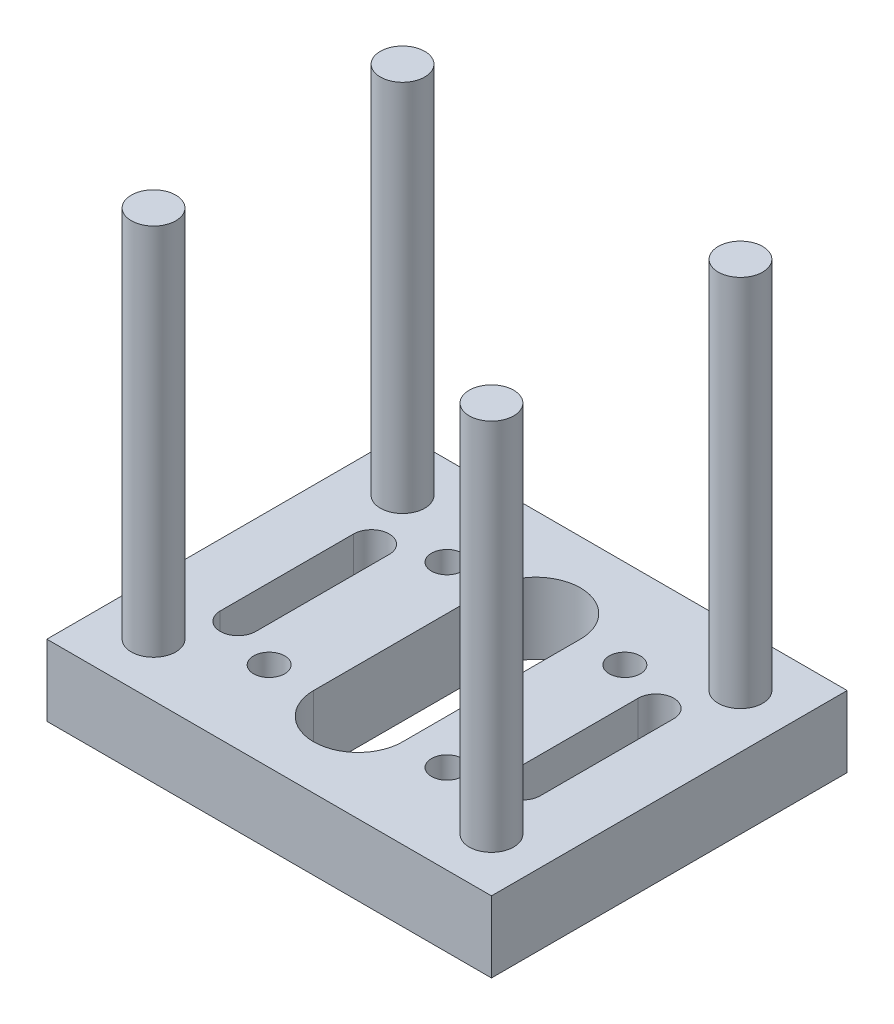
from build123d import *

# Parameters (mm, degrees)
SKETCH1_W            = 50
SKETCH1_H            = 40
SKETCH1_R            = 2.5
SKETCH1_R_2          = 1.75
MAIN_STRUCTURE_DEPTH = 8
SKETCH1_3_R          = 2.5
BOSS_EXTRUDE2_DEPTH  = 3
SKETCH1_4_R          = 2.5
SHAFTS_DEPTH         = 50


with BuildPart() as part:
    # Sketch1 → Main Structure (new body)
    with BuildSketch(Plane(origin=(0, 0, 0), x_dir=(1, 0, 0), z_dir=(0, 1, 0))):
        Rectangle(SKETCH1_W, SKETCH1_H)
        with Locations((-19, 14)):
            Circle(SKETCH1_R, mode=Mode.SUBTRACT)
        with Locations((-19, -14)):
            Circle(SKETCH1_R, mode=Mode.SUBTRACT)
        with Locations((19, 14)):
            Circle(SKETCH1_R, mode=Mode.SUBTRACT)
        with Locations((19, -14)):
            Circle(SKETCH1_R, mode=Mode.SUBTRACT)
        with Locations((-10, 10)):
            Circle(SKETCH1_R_2, mode=Mode.SUBTRACT)
        with Locations((-10, -10)):
            Circle(SKETCH1_R_2, mode=Mode.SUBTRACT)
        with Locations((10, -10)):
            Circle(SKETCH1_R_2, mode=Mode.SUBTRACT)
        with Locations((10, 10)):
            Circle(SKETCH1_R_2, mode=Mode.SUBTRACT)
        with BuildLine():
            Line((-14, 7.5), (-14, -7.5))
            ThreePointArc((-14, -7.5), (-16, -9.5), (-18, -7.5))
            Line((-18, -7.5), (-18, 7.5))
            ThreePointArc((-18, 7.5), (-16, 9.5), (-14, 7.5))
        make_face(mode=Mode.SUBTRACT)
        with BuildLine():
            Line((14, 7.5), (14, -7.5))
            ThreePointArc((14, -7.5), (16, -9.5), (18, -7.5))
            Line((18, -7.5), (18, 7.5))
            ThreePointArc((18, 7.5), (16, 9.5), (14, 7.5))
        make_face(mode=Mode.SUBTRACT)
        with BuildLine():
            Line((5, 10), (5, -10))
            ThreePointArc((5, -10), (0, -15), (-5, -10))
            Line((-5, -10), (-5, 10))
            ThreePointArc((-5, 10), (0, 15), (5, 10))
        make_face(mode=Mode.SUBTRACT)
    extrude(amount=MAIN_STRUCTURE_DEPTH)

    # Sketch1<3> → Boss-Extrude2 (add)
    with BuildSketch(Plane(origin=(0, 0, 0), x_dir=(1, 0, 0), z_dir=(0, 1, 0))):
        with Locations((-19, 14)):
            Circle(SKETCH1_3_R)
        with Locations((-19, -14)):
            Circle(SKETCH1_3_R)
        with Locations((19, 14)):
            Circle(SKETCH1_3_R)
        with Locations((19, -14)):
            Circle(SKETCH1_3_R)
    extrude(amount=BOSS_EXTRUDE2_DEPTH)

    # Sketch1<4> → Shafts (add)
    with BuildSketch(Plane(origin=(0, 0, 0), x_dir=(1, 0, 0), z_dir=(0, 1, 0))):
        with Locations((-19, 14)):
            Circle(SKETCH1_4_R)
        with Locations((-19, -14)):
            Circle(SKETCH1_4_R)
        with Locations((19, 14)):
            Circle(SKETCH1_4_R)
        with Locations((19, -14)):
            Circle(SKETCH1_4_R)
    extrude(amount=SHAFTS_DEPTH)


solid = part.part
